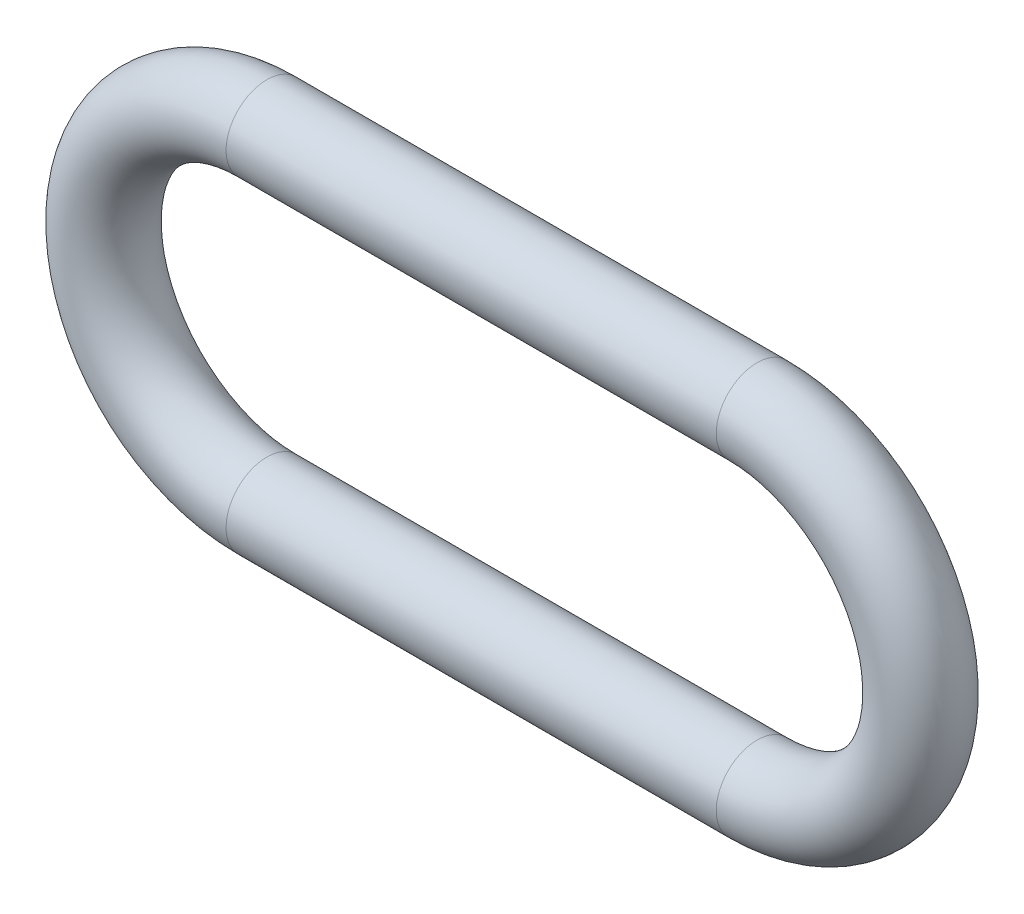
from build123d import *

# Parameters (mm, degrees)
SWEEP_1_PROFILE_R = 1


with BuildPart() as part:
    # 扫描1: sweep along a path in 草图1
    with BuildLine(Plane.XY) as sweep_1_path:
        Line((-6, -4), (6, -4))
        ThreePointArc((6, -4), (10, 0), (6, 4))
        Line((6, 4), (-6, 4))
        ThreePointArc((-6, 4), (-10, 0), (-6, -4))
    # 扫描1 profile (on start of the path) → 扫描1 (sweep)
    with BuildSketch(Plane(origin=(-6, -4, 0), x_dir=(0, 1, 0), z_dir=(1, 0, 0))):
        Circle(SWEEP_1_PROFILE_R)
    sweep(path=sweep_1_path.line)


solid = part.part
